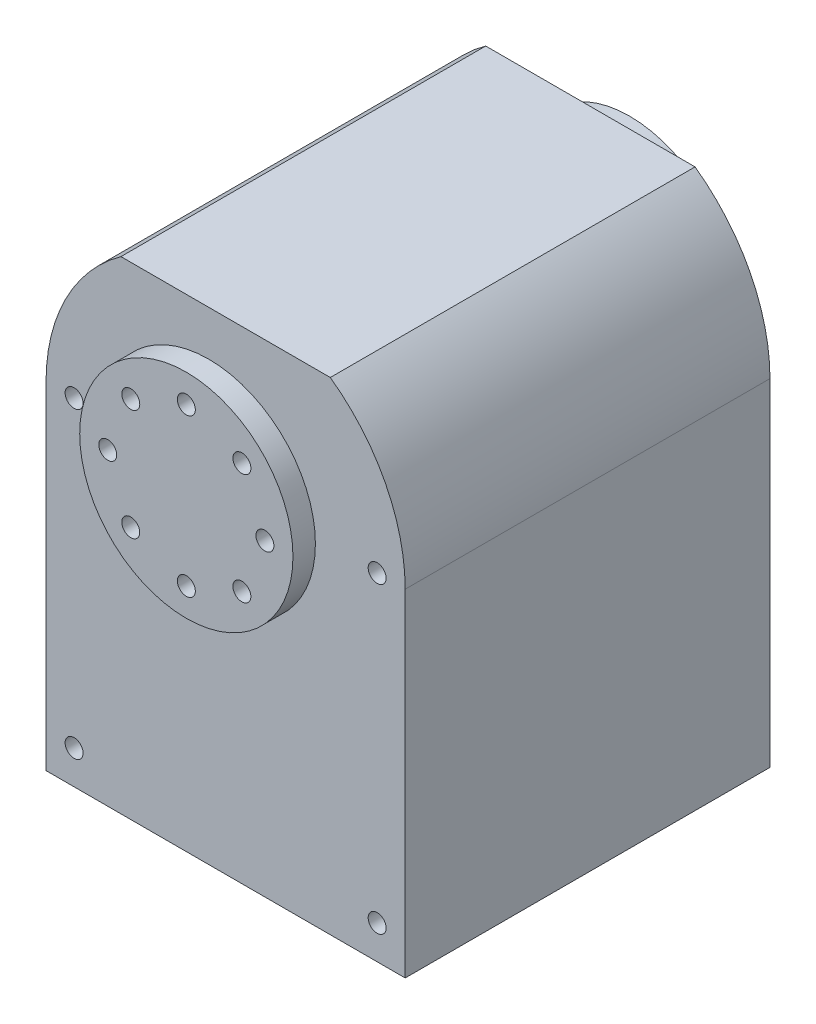
from build123d import *

# Parameters (mm, degrees)
SKETCH_1_R          = 0.8
SKETCH_1_R_2        = 1.5
EXTRUDE_1_DEPTH     = 32.5
SKETCH_2_R          = 4.5
EXTRUDE_2_DEPTH     = 1.5
SKETCH_3_R          = 9.5
EXTRUDE_3_DEPTH     = 2
CUT_EXTRUDE_1_REACH = 50.332
SKETCH_4_R          = 0.8


with BuildPart() as part:
    # ｽｹｯﾁ1 → ﾎﾞｽ - 押し出し1 (new body)
    with BuildSketch(Plane.XY):
        with BuildLine():
            Line((-9.327379053, 28), (9.327379053, 28))
            ThreePointArc((9.327379053, 28), (14.234431229, 22.306227999), (16, 15))
            Line((16, 15), (16, -15))
            Line((16, -15), (-16, -15))
            Line((-16, -15), (-16, 15))
            ThreePointArc((-16, 15), (-14.234431229, 22.306227999), (-9.327379053, 28))
        make_face()
        with Locations((-13.5, -12)):
            Circle(SKETCH_1_R, mode=Mode.SUBTRACT)
        with Locations((13.5, -12)):
            Circle(SKETCH_1_R, mode=Mode.SUBTRACT)
        with Locations((-13.5, 15)):
            Circle(SKETCH_1_R, mode=Mode.SUBTRACT)
        with Locations((13.5, 15)):
            Circle(SKETCH_1_R, mode=Mode.SUBTRACT)
        with Locations((0, 16)):
            Circle(SKETCH_1_R_2, mode=Mode.SUBTRACT)
    extrude(amount=EXTRUDE_1_DEPTH)

    # ｽｹｯﾁ2 → ﾎﾞｽ - 押し出し2 (add)
    with BuildSketch(Plane(origin=(0, 0, 0), x_dir=(-1, 0, 0), z_dir=(0, 0, -1))):
        with Locations((0, 16)):
            Circle(SKETCH_2_R)
    extrude_2 = extrude(amount=EXTRUDE_2_DEPTH)

    # ｽｹｯﾁ3 → ﾎﾞｽ - 押し出し3 (add)
    with BuildSketch(Plane(origin=(0, 0, -1.5), x_dir=(-1, 0, 0), z_dir=(0, 0, -1))):
        with Locations((0, 16)):
            Circle(SKETCH_3_R)
    extrude_3 = extrude(amount=EXTRUDE_3_DEPTH)

    # ｽｹｯﾁ4 → ｶｯﾄ - 押し出し1 (cut, up to next)
    with BuildSketch(Plane(origin=(0, 0, -3.5), x_dir=(-1, 0, 0), z_dir=(0, 0, -1)), mode=Mode.PRIVATE) as cut_extrude_1_sk1:
        with Locations((0, 23)):
            Circle(SKETCH_4_R)
    cut_extrude_1_tool1 = extrude(cut_extrude_1_sk1.sketch, amount=-CUT_EXTRUDE_1_REACH, mode=Mode.PRIVATE) & part.part
    # ｽｹｯﾁ4 → ｶｯﾄ - 押し出し1 (cut, up to next)
    with BuildSketch(Plane(origin=(0, 0, -3.5), x_dir=(-1, 0, 0), z_dir=(0, 0, -1)), mode=Mode.PRIVATE) as cut_extrude_1_sk2:
        with Locations((4.949747468, 20.949747468)):
            Circle(SKETCH_4_R)
    cut_extrude_1_tool2 = extrude(cut_extrude_1_sk2.sketch, amount=-CUT_EXTRUDE_1_REACH, mode=Mode.PRIVATE) & part.part
    # ｽｹｯﾁ4 → ｶｯﾄ - 押し出し1 (cut, up to next)
    with BuildSketch(Plane(origin=(0, 0, -3.5), x_dir=(-1, 0, 0), z_dir=(0, 0, -1)), mode=Mode.PRIVATE) as cut_extrude_1_sk3:
        with Locations((7, 16)):
            Circle(SKETCH_4_R)
    cut_extrude_1_tool3 = extrude(cut_extrude_1_sk3.sketch, amount=-CUT_EXTRUDE_1_REACH, mode=Mode.PRIVATE) & part.part
    # ｽｹｯﾁ4 → ｶｯﾄ - 押し出し1 (cut, up to next)
    with BuildSketch(Plane(origin=(0, 0, -3.5), x_dir=(-1, 0, 0), z_dir=(0, 0, -1)), mode=Mode.PRIVATE) as cut_extrude_1_sk4:
        with Locations((4.949747468, 11.050252532)):
            Circle(SKETCH_4_R)
    cut_extrude_1_tool4 = extrude(cut_extrude_1_sk4.sketch, amount=-CUT_EXTRUDE_1_REACH, mode=Mode.PRIVATE) & part.part
    # ｽｹｯﾁ4 → ｶｯﾄ - 押し出し1 (cut, up to next)
    with BuildSketch(Plane(origin=(0, 0, -3.5), x_dir=(-1, 0, 0), z_dir=(0, 0, -1)), mode=Mode.PRIVATE) as cut_extrude_1_sk5:
        with Locations((0, 9)):
            Circle(SKETCH_4_R)
    cut_extrude_1_tool5 = extrude(cut_extrude_1_sk5.sketch, amount=-CUT_EXTRUDE_1_REACH, mode=Mode.PRIVATE) & part.part
    # ｽｹｯﾁ4 → ｶｯﾄ - 押し出し1 (cut, up to next)
    with BuildSketch(Plane(origin=(0, 0, -3.5), x_dir=(-1, 0, 0), z_dir=(0, 0, -1)), mode=Mode.PRIVATE) as cut_extrude_1_sk6:
        with Locations((-4.949747468, 11.050252532)):
            Circle(SKETCH_4_R)
    cut_extrude_1_tool6 = extrude(cut_extrude_1_sk6.sketch, amount=-CUT_EXTRUDE_1_REACH, mode=Mode.PRIVATE) & part.part
    # ｽｹｯﾁ4 → ｶｯﾄ - 押し出し1 (cut, up to next)
    with BuildSketch(Plane(origin=(0, 0, -3.5), x_dir=(-1, 0, 0), z_dir=(0, 0, -1)), mode=Mode.PRIVATE) as cut_extrude_1_sk7:
        with Locations((-7, 16)):
            Circle(SKETCH_4_R)
    cut_extrude_1_tool7 = extrude(cut_extrude_1_sk7.sketch, amount=-CUT_EXTRUDE_1_REACH, mode=Mode.PRIVATE) & part.part
    # ｽｹｯﾁ4 → ｶｯﾄ - 押し出し1 (cut, up to next)
    with BuildSketch(Plane(origin=(0, 0, -3.5), x_dir=(-1, 0, 0), z_dir=(0, 0, -1)), mode=Mode.PRIVATE) as cut_extrude_1_sk8:
        with Locations((-4.949747468, 20.949747468)):
            Circle(SKETCH_4_R)
    cut_extrude_1_tool8 = extrude(cut_extrude_1_sk8.sketch, amount=-CUT_EXTRUDE_1_REACH, mode=Mode.PRIVATE) & part.part
    cut_extrude_1_1 = cut_extrude_1_tool1.solids().sort_by_distance((0, 23, -3.5))[0]
    add(cut_extrude_1_1, mode=Mode.SUBTRACT)
    cut_extrude_1_2 = cut_extrude_1_tool2.solids().sort_by_distance((-4.949747, 20.949747, -3.5))[0]
    add(cut_extrude_1_2, mode=Mode.SUBTRACT)
    cut_extrude_1_3 = cut_extrude_1_tool3.solids().sort_by_distance((-7, 16, -3.5))[0]
    add(cut_extrude_1_3, mode=Mode.SUBTRACT)
    cut_extrude_1_4 = cut_extrude_1_tool4.solids().sort_by_distance((-4.949747, 11.050253, -3.5))[0]
    add(cut_extrude_1_4, mode=Mode.SUBTRACT)
    cut_extrude_1_5 = cut_extrude_1_tool5.solids().sort_by_distance((0, 9, -3.5))[0]
    add(cut_extrude_1_5, mode=Mode.SUBTRACT)
    cut_extrude_1_6 = cut_extrude_1_tool6.solids().sort_by_distance((4.949747, 11.050253, -3.5))[0]
    add(cut_extrude_1_6, mode=Mode.SUBTRACT)
    cut_extrude_1_7 = cut_extrude_1_tool7.solids().sort_by_distance((7, 16, -3.5))[0]
    add(cut_extrude_1_7, mode=Mode.SUBTRACT)
    cut_extrude_1_8 = cut_extrude_1_tool8.solids().sort_by_distance((4.949747, 20.949747, -3.5))[0]
    add(cut_extrude_1_8, mode=Mode.SUBTRACT)
    cut_extrude_1 = cut_extrude_1_1 + cut_extrude_1_2 + cut_extrude_1_3 + cut_extrude_1_4 + cut_extrude_1_5 + cut_extrude_1_6 + cut_extrude_1_7 + cut_extrude_1_8  # ｶｯﾄ - 押し出し1 as one shape, for the pattern or mirror that repeats it

    # ﾐﾗｰ1: ﾎﾞｽ - 押し出し2, ﾎﾞｽ - 押し出し3, ｶｯﾄ - 押し出し1 across plane
    add(extrude_2.mirror(Plane(origin=(0, 0, 16.25), x_dir=(1, 0, 0), z_dir=(0, 0, -1))))
    add(extrude_3.mirror(Plane(origin=(0, 0, 16.25), x_dir=(1, 0, 0), z_dir=(0, 0, -1))))
    add(cut_extrude_1.mirror(Plane(origin=(0, 0, 16.25), x_dir=(1, 0, 0), z_dir=(0, 0, -1))), mode=Mode.SUBTRACT)


solid = part.part
